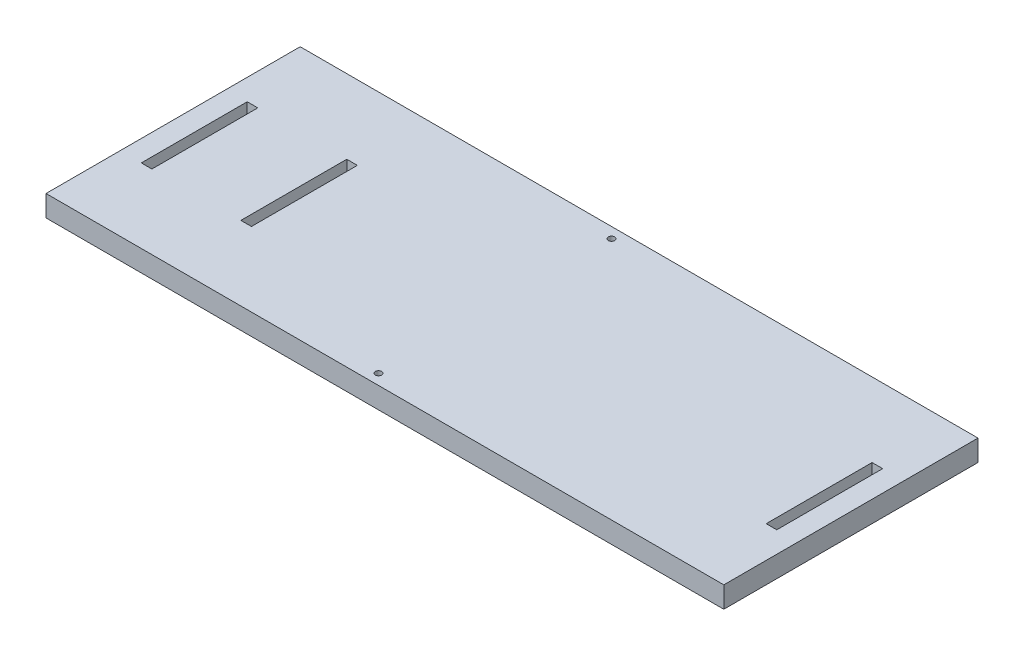
from build123d import *

# Parameters (mm, degrees)
SKETCH1_W           = 320
SKETCH1_H           = 80
SKETCH1_W_2         = 5
SKETCH1_H_2         = 50
BOSS_EXTRUDE1_DEPTH = 10
SKETCH2_W           = 320
SKETCH2_H           = 20
BOSS_EXTRUDE2_DEPTH = 10
SKETCH3_R           = 1.5
CUT_EXTRUDE1_DEPTH  = 10


with BuildPart() as part:
    # Sketch1 → Boss-Extrude1 (new body)
    with BuildSketch(Plane(origin=(0, 0, 0), x_dir=(1, 0, 0), z_dir=(0, 1, 0))):
        with Locations((160, -40)):
            Rectangle(SKETCH1_W, SKETCH1_H)
        with Locations((12.5, -40)):
            Rectangle(SKETCH1_W_2, SKETCH1_H_2, mode=Mode.SUBTRACT)
        with Locations((59.5, -40)):
            Rectangle(SKETCH1_W_2, SKETCH1_H_2, mode=Mode.SUBTRACT)
        with Locations((307.5, -40)):
            Rectangle(SKETCH1_W_2, SKETCH1_H_2, mode=Mode.SUBTRACT)
    extrude(amount=BOSS_EXTRUDE1_DEPTH)

    # Sketch2 → Boss-Extrude2 (add)
    with BuildSketch(Plane(origin=(0, 10, 0), x_dir=(1, 0, 0), z_dir=(0, 1, 0))):
        with Locations((160, 10)):
            Rectangle(SKETCH2_W, SKETCH2_H)
        with Locations((160, -90)):
            Rectangle(SKETCH2_W, SKETCH2_H)
    extrude(amount=-BOSS_EXTRUDE2_DEPTH)

    # Sketch3 → Cut-Extrude1 (cut)
    with BuildSketch(Plane(origin=(0, 10, 0), x_dir=(1, 0, 0), z_dir=(0, 1, 0))):
        with Locations(Location((152, 15, 0), (0, 0, 270))):
            Circle(SKETCH3_R)
        with Locations(Location((152, -95, 0), (0, 0, 90))):
            Circle(SKETCH3_R)
    extrude(amount=-CUT_EXTRUDE1_DEPTH, mode=Mode.SUBTRACT)


solid = part.part
